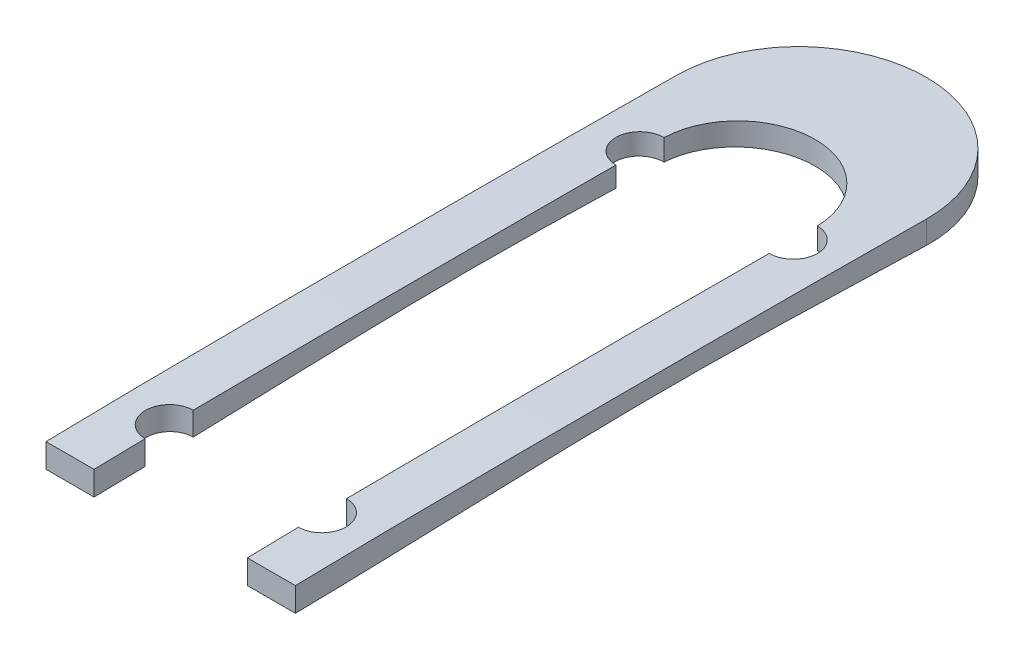
from build123d import *

# Parameters (mm, degrees)
BOSS_EXTRUDE2_DEPTH = 10
CUT_EXTRUDE1_REACH  = 134.798
CUT_EXTRUDE2_REACH  = 134.58


with BuildPart() as part:
    # Sketch1 → Boss-Extrude2 (new body)
    with BuildSketch(Plane(origin=(0, 0, 0), x_dir=(1, 0, 0), z_dir=(0, 1, 0))):
        with BuildLine():
            Line((-20.75, 0), (-12.75, 0))
            Line((-12.75, 0), (-12.75, 8.502685995))
            ThreePointArc((-12.75, 8.502685995), (-16.75, 12.502685995), (-12.75, 16.502685995))
            Line((-12.75, 16.502685995), (-12.75, 86.85))
            ThreePointArc((-12.75, 86.85), (-16.749999279, 90.852402374), (-12.745195252, 94.849997114))
            ThreePointArc((-12.745195252, 94.849997114), (0, 107.25), (12.745195252, 94.849997114))
            ThreePointArc((12.745195252, 94.849997114), (16.749999279, 90.852402374), (12.75, 86.85))
            Line((12.75, 86.85), (12.75, 16.502685995))
            ThreePointArc((12.75, 16.502685995), (16.75, 12.502685995), (12.75, 8.502685995))
            Line((12.75, 8.502685995), (12.75, 0))
            Line((12.75, 0), (20.75, 0))
            Line((20.75, 0), (20.75, 105))
            ThreePointArc((20.75, 105), (0, 125.75), (-20.75, 105))
            Line((-20.75, 105), (-20.75, 0))
        make_face()
    extrude(amount=BOSS_EXTRUDE2_DEPTH)

    # Cut-Extrude1: up to this face of the body (flat: up to its plane)
    cut_extrude1_end = Plane(part.part.faces().sort_by_distance((-20.75, 5, -52.5))[0])
    # Sketch2 → Cut-Extrude1 (cut, up to the picked face)
    with BuildSketch(Plane(origin=(20.75, 0, 0), x_dir=(0, 0, -1), z_dir=(1, 0, 0)), mode=Mode.PRIVATE) as cut_extrude1_sk1:
        with BuildLine():
            Line((0, 10), (0, 6))
            add(Edge.make_bspline(
                [(0, 6), (20.380438902, 6.489130534), (49.317340974, 6.513055303), (79.861692853, 6.559373615), (105, 6.320685747)],
                knots=[0, 0, 0, 0, 0, 0.815217556, 0.815217556, 0.815217556, 0.815217556, 0.815217556], degree=4))
            Line((105, 6.320685747), (105, 10))
            Line((105, 10), (0, 10))
        make_face()
    cut_extrude1_tool1 = split(extrude(cut_extrude1_sk1.sketch, amount=-CUT_EXTRUDE1_REACH, mode=Mode.PRIVATE), bisect_by=cut_extrude1_end, keep=Keep.BOTH, mode=Mode.PRIVATE)
    # Sketch2 → Cut-Extrude1 (cut, up to the picked face)
    with BuildSketch(Plane(origin=(20.75, 0, 0), x_dir=(0, 0, -1), z_dir=(1, 0, 0)), mode=Mode.PRIVATE) as cut_extrude1_sk2:
        with BuildLine():
            Line((105, 10), (105, 6.320685747))
            add(Edge.make_bspline(
                [(105, 6.320685747), (110.698010054, 6.266583223), (116.118270151, 6.197837747), (121.179103999, 6.110869466), (125.798665098, 6)],
                knots=[0.815217556, 0.815217556, 0.815217556, 0.815217556, 0.815217556, 1, 1, 1, 1, 1], degree=4))
            Line((125.798665098, 6), (125.75, 10))
            Line((125.75, 10), (105, 10))
        make_face()
    cut_extrude1_tool2 = split(extrude(cut_extrude1_sk2.sketch, amount=-CUT_EXTRUDE1_REACH, mode=Mode.PRIVATE), bisect_by=cut_extrude1_end, keep=Keep.BOTH, mode=Mode.PRIVATE)
    add(cut_extrude1_tool1.solids().sort_by(Axis((20.75, 8.191223, -51.89052), (-1, 0, 0)))[0], mode=Mode.SUBTRACT)
    add(cut_extrude1_tool2.solids().sort_by(Axis((20.75, 8.09056, -115.529992), (-1, 0, 0)))[0], mode=Mode.SUBTRACT)

    # Cut-Extrude2: up to this face of the body (flat: up to its plane)
    cut_extrude2_end = Plane(part.part.faces().sort_by_distance((-20.75, 3.194161628, -52.844890182))[0])
    # Sketch3 → Cut-Extrude2 (cut, up to the picked face)
    with BuildSketch(Plane(origin=(20.75, 0, 0), x_dir=(0, 0, -1), z_dir=(1, 0, 0)), mode=Mode.PRIVATE) as cut_extrude2_sk1:
        with BuildLine():
            Line((0, 0), (0, 2))
            add(Edge.make_bspline(
                [(0, 2), (20.957324469, 2.318248008), (62.875, 4.681751992), (104.792675531, 2.318248008), (125.75, 2)],
                knots=[0, 0, 0, 0, 0.5, 1, 1, 1, 1], degree=3))
            Line((125.75, 2), (125.75, 0))
            Line((125.75, 0), (0, 0))
        make_face()
    cut_extrude2_tool1 = split(extrude(cut_extrude2_sk1.sketch, amount=-CUT_EXTRUDE2_REACH, mode=Mode.PRIVATE), bisect_by=cut_extrude2_end, keep=Keep.BOTH, mode=Mode.PRIVATE)
    add(cut_extrude2_tool1.solids().sort_by(Axis((20.75, 1.458103, -62.875), (-1, 0, 0)))[0], mode=Mode.SUBTRACT)


solid = part.part
